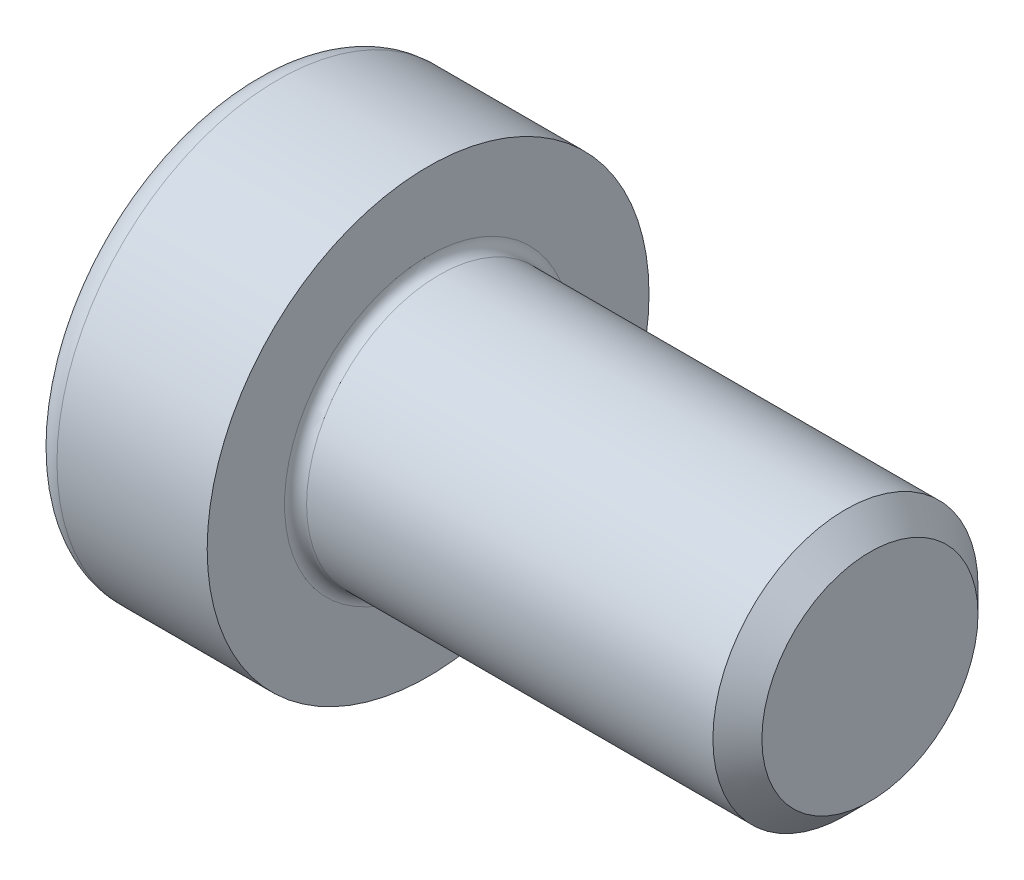
from build123d import *

# Parameters (mm, degrees)
FILLET1_R   = 0.25
FILLET2_R   = 0.6
HEX_2_DEPTH = 2.5


with BuildPart() as part:
    # BodySke → Base-Revolve (revolve)
    with BuildSketch(Plane.XY, mode=Mode.PRIVATE) as base_revolve_sk:
        Polygon((0, 0), (0, 5), (4, 5), (4, 3), (13.4455, 3), (14, 2.4455), (14, 0), align=None)
    revolve(base_revolve_sk.sketch.rotate(Axis((-31.75, 0, 0), (1, 0, 0)), 90), axis=Axis((-31.75, 0, 0), (1, 0, 0)))

    # Fillet1
    fillet1_edges = [part.edges().sort_by_distance(p)[0] for p in [
        (4, 0, -3),
    ]]
    fillet(fillet1_edges, radius=FILLET1_R)

    # Fillet2
    fillet2_edges = [part.edges().sort_by_distance(p)[0] for p in [
        (0, 0, -5),
    ]]
    fillet(fillet2_edges, radius=FILLET2_R)

    # HexSke → Hex 2 (cut)
    with BuildSketch(Plane(origin=(0, 0, 0), x_dir=(0, 0.500000000000001, 0.866025403784438), z_dir=(-1, 0, 0))):
        Polygon((1.443375673, 2.5), (-1.443375673, 2.5), (-2.886751346, 0), (-1.443375673, -2.5), (1.443375673, -2.5), (2.886751346, 0), align=None)
    extrude(amount=-HEX_2_DEPTH, mode=Mode.SUBTRACT)

    # PilotSke → Hex-PreBroach (revolve, cut)
    with BuildSketch(Plane.XY, mode=Mode.PRIVATE) as hex_prebroach_sk:
        Polygon((0, 2.5), (2.5, 2.5), (3.077350269, 1.5), (5, 1.5), (5.866025404, 0), (0, 0), align=None)
    revolve(hex_prebroach_sk.sketch.rotate(Axis((0, 0, 0), (1, 0, 0)), 90), axis=Axis((0, 0, 0), (1, 0, 0)), mode=Mode.SUBTRACT)


solid = part.part
